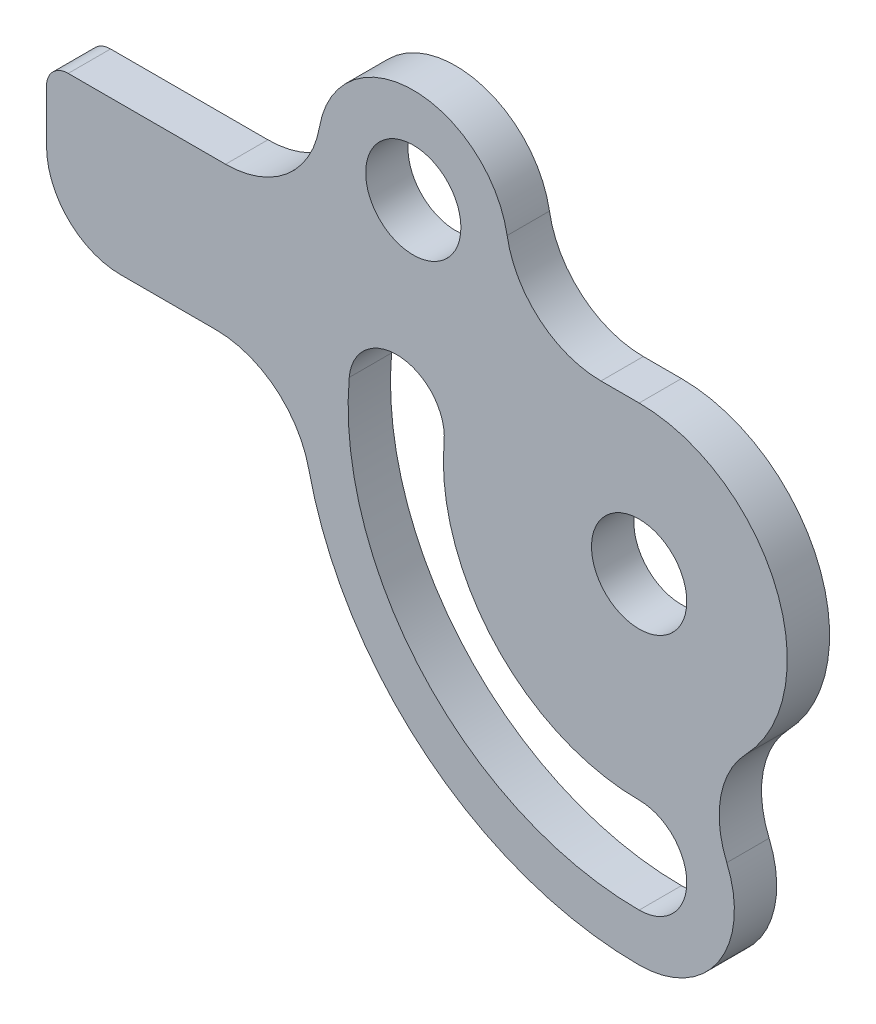
from build123d import *

# Parameters (mm, degrees)
SKETCH1_R           = 1.7859375
BOSS_EXTRUDE1_DEPTH = 1.5875
FILLET1_R           = 3.571875


with BuildPart() as part:
    # Sketch1 → Boss-Extrude1 (new body)
    with BuildSketch(Plane.XY):
        with BuildLine():
            Line((2.778125, 0), (9.525, 0))
            ThreePointArc((9.525, 0), (13.244743879, -8.980256121), (22.225, -12.7))
            ThreePointArc((22.225, -12.7), (25.796875, -9.128125), (22.225, -5.55625))
            ThreePointArc((22.225, -5.55625), (27.78125, 0), (22.225, 5.55625))
            Line((22.225, 5.55625), (16.439019559, 5.55625))
            ThreePointArc((16.439019559, 5.55625), (13.754229109, 11.484009389), (11.069438658, 5.55625))
            Line((11.069438658, 5.55625), (0.813693974, 5.55625))
            ThreePointArc((0.813693974, 5.55625), (0.238325447, 5.317924553), (0, 4.742556026))
            Line((0, 4.742556026), (0, 2.778125))
            ThreePointArc((0, 2.778125), (0.813693974, 0.813693974), (2.778125, 0))
        make_face()
        with BuildLine():
            ThreePointArc((14.91075174, 0.639913805), (16.811771554, -4.960309977), (22.225, -7.3421875))
            ThreePointArc((22.225, -7.3421875), (24.0109375, -9.128125), (22.225, -10.9140625))
            ThreePointArc((22.225, -10.9140625), (14.178309066, -7.37343375), (11.352468803, 0.951223224))
            ThreePointArc((11.352468803, 0.951223224), (13.287264981, 2.574709983), (14.91075174, 0.639913805))
        make_face(mode=Mode.SUBTRACT)
        with Locations((22.225, 0)):
            Circle(SKETCH1_R, mode=Mode.SUBTRACT)
        with Locations((13.754229109, 7.912134389)):
            Circle(SKETCH1_R, mode=Mode.SUBTRACT)
    extrude(amount=BOSS_EXTRUDE1_DEPTH)

    # Fillet1
    fillet1_edges = [part.edges().sort_by_distance(p)[0] for p in [
        (22.225, -5.55625, 0.79375),
        (16.439019559, 5.55625, 0.79375),
        (11.069438658, 5.55625, 0.79375),
        (9.525, 0, 0.79375),
    ]]
    fillet(fillet1_edges, radius=FILLET1_R)


solid = part.part
